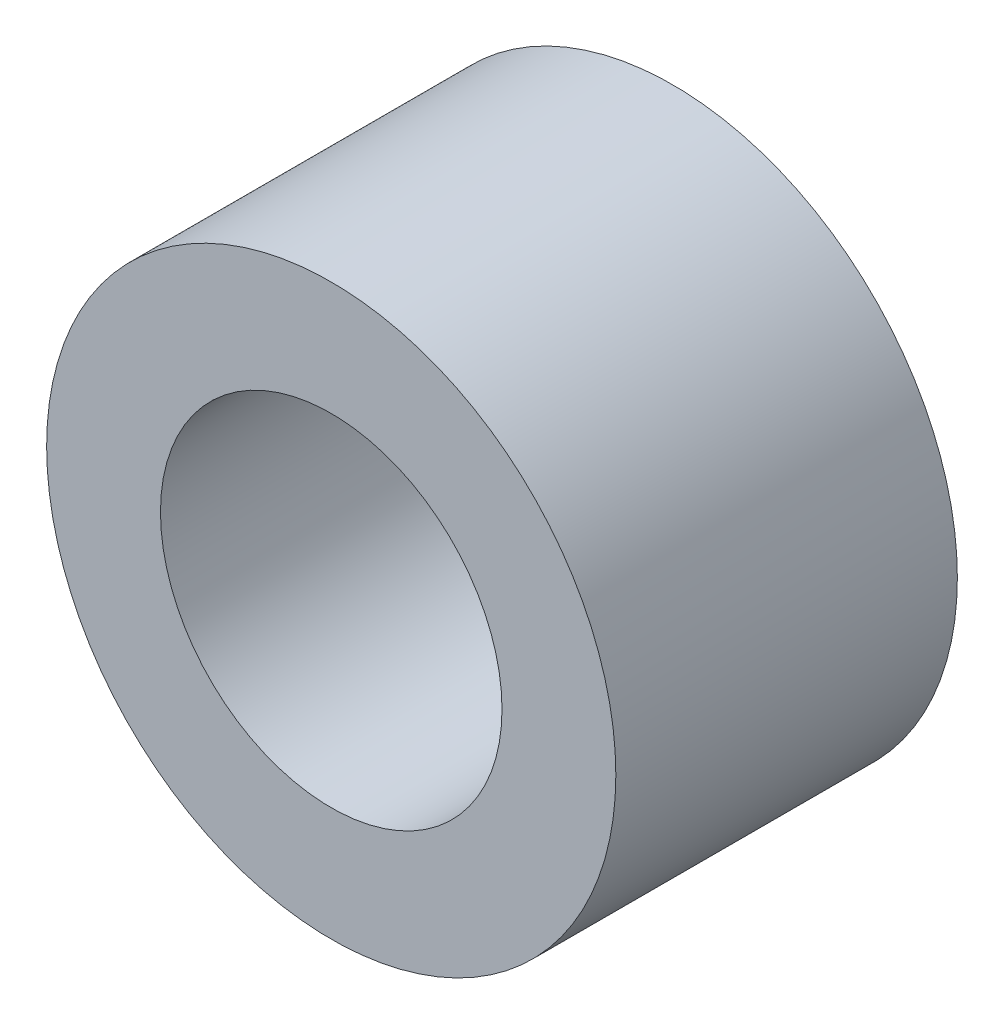
from build123d import *

# Parameters (mm, degrees)
SKETCH1_R           = 2.5
SKETCH1_R_2         = 1.5
BOSS_EXTRUDE1_DEPTH = 1.5


with BuildPart() as part:
    # Sketch1 → Boss-Extrude1 (new, symmetric)
    with BuildSketch(Plane.XY):
        Circle(SKETCH1_R)
        Circle(SKETCH1_R_2, mode=Mode.SUBTRACT)
    extrude(amount=BOSS_EXTRUDE1_DEPTH, both=True)


solid = part.part
